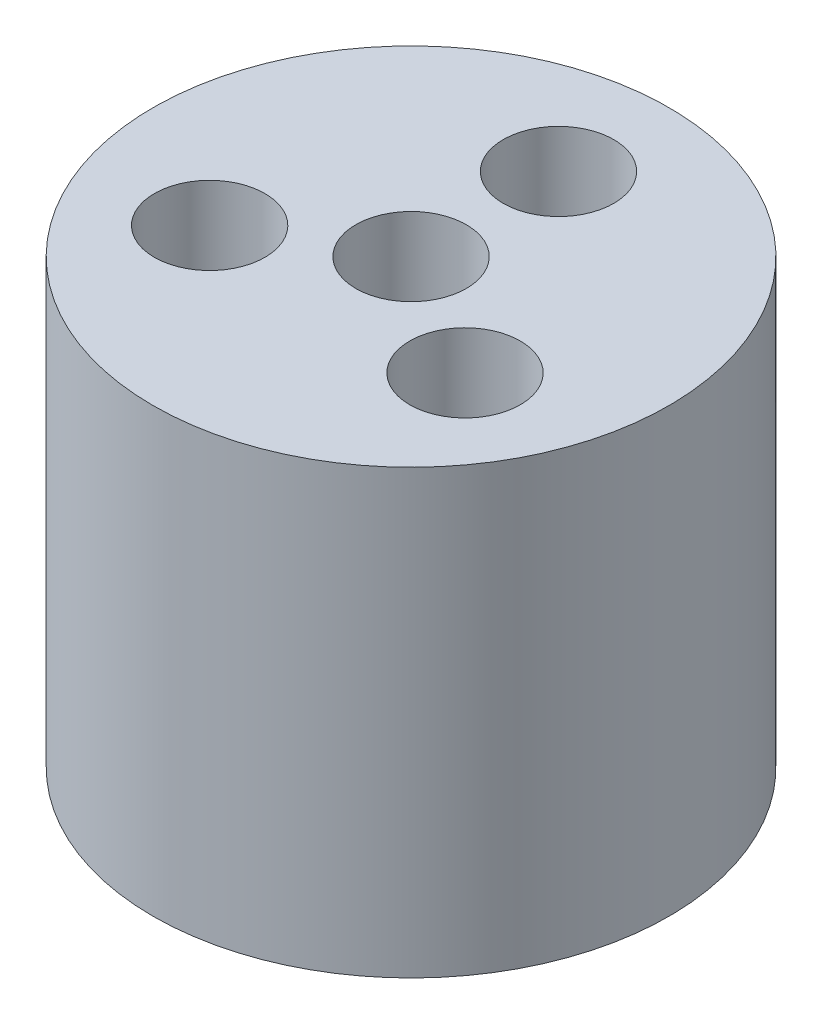
from build123d import *

# Parameters (mm, degrees)
SKETCH_1_R               = 14
EXTRUDE_1_DEPTH          = 12
HOLE_WIZARD_6_0_6_1_D    = 6
HOLE_WIZARD_6_0_6_2_D    = 6
PATTERN_CIRCULAR_1_COUNT = 3


with BuildPart() as part:
    # 스케치1 → 보스-돌출1 (new, symmetric)
    with BuildSketch(Plane(origin=(0, 0, 0), x_dir=(1, 0, 0), z_dir=(0, 1, 0))):
        with Locations(Location((0, 0, 0), (0, 0, 270))):
            Circle(SKETCH_1_R)
    extrude(amount=EXTRUDE_1_DEPTH, both=True)

    # Ø6.0 (6) 지름 구멍1 (through all)
    with Locations(Plane(origin=(0, 12, 0), x_dir=(1, 0, 0), z_dir=(0, 1, 0))):
        with Locations((0, 0)):
            Hole(HOLE_WIZARD_6_0_6_1_D / 2)

    # Ø6.0 (6) 지름 구멍2 (through all)
    with Locations(Plane(origin=(0, 12, 0), x_dir=(1, 0, 0), z_dir=(0, 1, 0))):
        with Locations((0, 8)):
            hole_wizard_6_0_6_2 = Hole(HOLE_WIZARD_6_0_6_2_D / 2)

    # 원형 패턴1: Ø6.0 (6) 지름 구멍2 ×3 about axis
    pattern_circular_1_axis = Axis((0, 0, 0), (0, 1, 0))
    for i in range(1, PATTERN_CIRCULAR_1_COUNT):
        add(hole_wizard_6_0_6_2.rotate(pattern_circular_1_axis, i * 360 / PATTERN_CIRCULAR_1_COUNT), mode=Mode.SUBTRACT)


solid = part.part
